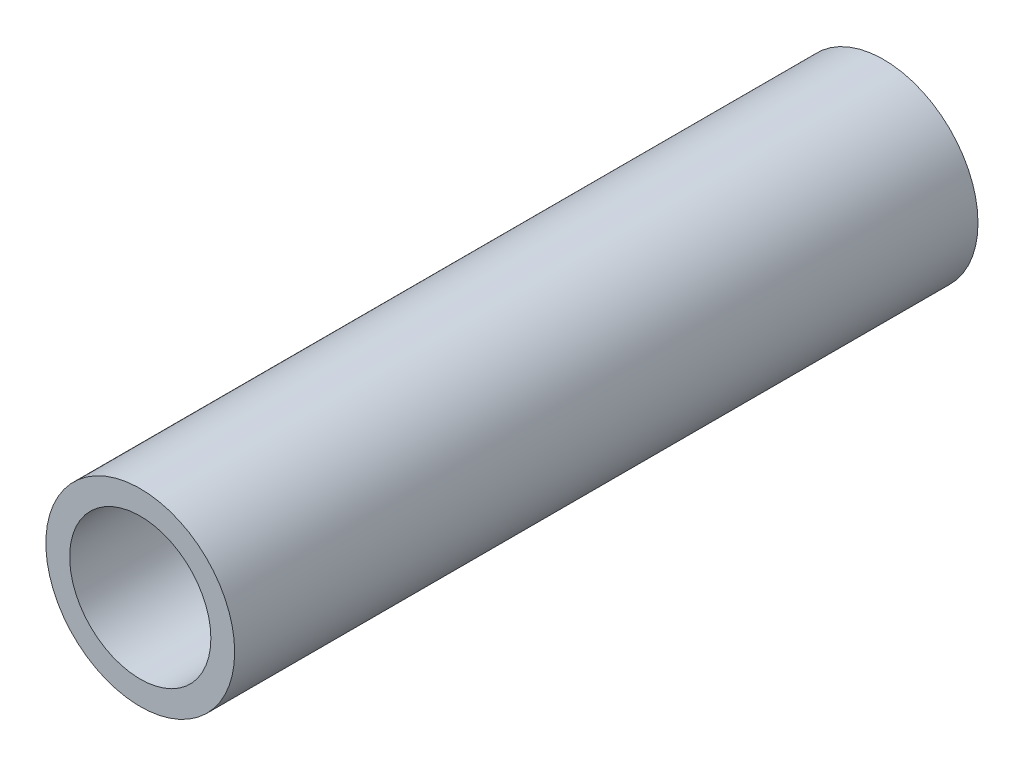
from build123d import *

# Parameters (mm, degrees)
CROQUIS1_R              = 12.7
CROQUIS1_R_2            = 9.5
SALIENTE_EXTRUIR1_DEPTH = 50


with BuildPart() as part:
    # Croquis1 → Saliente-Extruir1 (new, symmetric)
    with BuildSketch(Plane.XY):
        Circle(CROQUIS1_R)
        Circle(CROQUIS1_R_2, mode=Mode.SUBTRACT)
    extrude(amount=SALIENTE_EXTRUIR1_DEPTH, both=True)


solid = part.part
